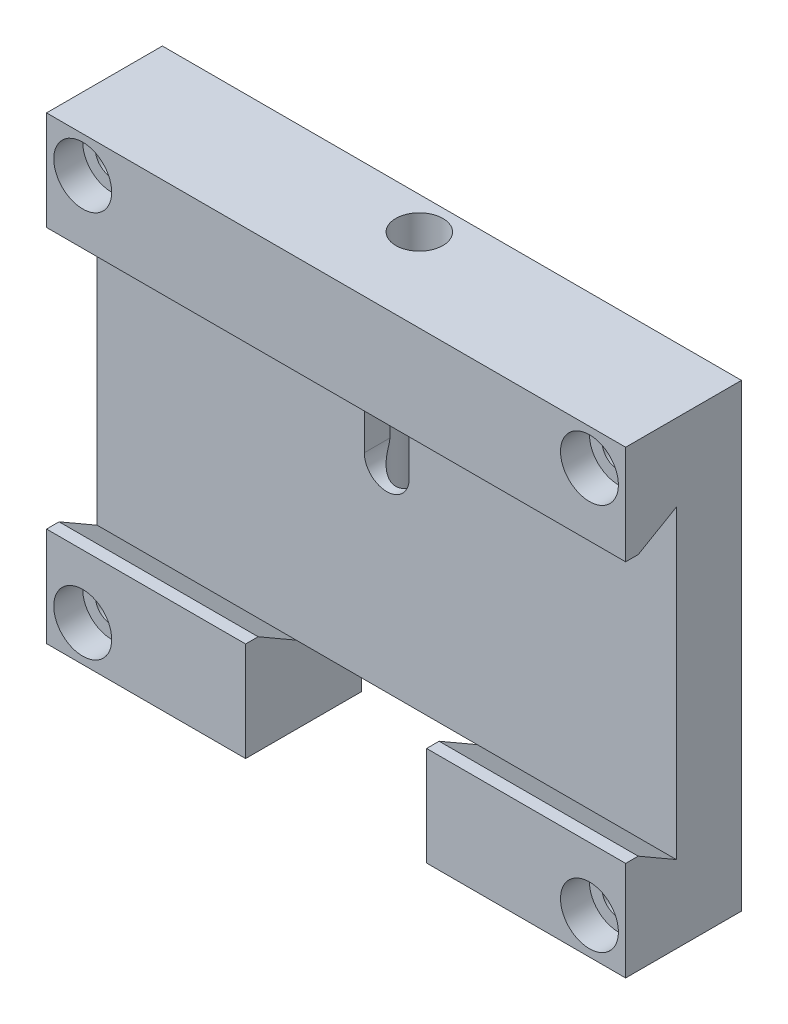
from build123d import *
from OCP.BRepFilletAPI import BRepFilletAPI_MakeChamfer

# Parameters (mm, degrees)
SKETCH_1_W                  = 80
SKETCH_1_H                  = 63.5
EXTRUDE_1_DEPTH             = 16
CUT_EXTRUDE_1_DEPTH         = 104.383992958
SKETCH_15_W                 = 25
SKETCH_15_H                 = 14.711451884
CUT_EXTRUDE_4_DEPTH         = 7
SKETCH_16_W                 = 25
SKETCH_16_H                 = 10.67
CUT_EXTRUDE_5_DEPTH         = 9
SKETCH_17_R                 = 2.5
CUT_EXTRUDE_6_DEPTH         = 4
M4X0_72_D                   = 3.3
M4X0_72_DEPTH               = 10
M4X0_72_TIP                 = 0.991420021
CUT_EXTRUDE_7_DEPTH         = 4
SKETCH_26_R                 = 3.25
CUT_EXTRUDE_8_DEPTH         = 38
HOLE_WIZARD_M41_D           = 4.5
HOLE_WIZARD_M41_CBORE_D     = 8
HOLE_WIZARD_M41_CBORE_DEPTH = 4
CHAMFER_2_SIZE              = 1
CHAMFER_2_SIZE2             = 2


with BuildPart() as part:
    # Эскиз1 → Бобышка-Вытянуть1 (new body)
    with BuildSketch(Plane.XY):
        with Locations((40, -31.75)):
            Rectangle(SKETCH_1_W, SKETCH_1_H)
    extrude(amount=EXTRUDE_1_DEPTH)

    # Эскиз2 → Вырез-Вытянуть1 (cut, through all)
    with BuildSketch(Plane.ZY):
        Polygon((9, -10.67), (16, -14.711451884), (16, -48.788548116), (9, -52.83), align=None)
    extrude(amount=-CUT_EXTRUDE_1_DEPTH, mode=Mode.SUBTRACT)

    # Эскиз15 → Вырез-Вытянуть4 (cut)
    with BuildSketch(Plane.XY.offset(16)):
        with Locations((40, -56.144274058)):
            Rectangle(SKETCH_15_W, SKETCH_15_H)
    extrude(amount=-CUT_EXTRUDE_4_DEPTH, mode=Mode.SUBTRACT)

    # Эскиз16 → Вырез-Вытянуть5 (cut)
    with BuildSketch(Plane.XY.offset(9)):
        with Locations((40, -58.165)):
            Rectangle(SKETCH_16_W, SKETCH_16_H)
    extrude(amount=-CUT_EXTRUDE_5_DEPTH, mode=Mode.SUBTRACT)

    # Эскиз17 → Вырез-Вытянуть6 (cut)
    with BuildSketch(Plane.XZ.offset(52.83)):
        with Locations(Location((32.5, 5, 0), (0, 0, 270))):
            Circle(SKETCH_17_R)
        with Locations(Location((47.5, 5, 0), (0, 0, 90))):
            Circle(SKETCH_17_R)
    extrude(amount=-CUT_EXTRUDE_6_DEPTH, mode=Mode.SUBTRACT)

    # Отверстие обработанное метчиком M4x0.72
    with Locations(Plane(origin=(0, -52.83, 0), x_dir=(-1, 0, 0), z_dir=(0, -1, 0))):
        with Locations((-40, -5)):
            Hole(M4X0_72_D / 2, depth=M4X0_72_DEPTH)
            with Locations((0, 0, -(M4X0_72_DEPTH + M4X0_72_TIP / 2))):  # 118° drill point
                Cone(0, M4X0_72_D / 2, M4X0_72_TIP, mode=Mode.SUBTRACT)

    # Эскиз25 → Вырез-Вытянуть7 (cut)
    with BuildSketch(Plane.XY.offset(9)):
        with BuildLine():
            Line((43.1, -18.711451884), (43.1, -25.711451884))
            ThreePointArc((43.1, -25.711451884), (40, -28.811451884), (36.9, -25.711451884))
            Line((36.9, -25.711451884), (36.9, -18.711451884))
            ThreePointArc((36.9, -18.711451884), (40, -15.611451884), (43.1, -18.711451884))
        make_face()
    extrude(amount=-CUT_EXTRUDE_7_DEPTH, mode=Mode.SUBTRACT)

    # Эскиз26 → Вырез-Вытянуть8 (cut)
    with BuildSketch(Plane(origin=(0, 0, 0), x_dir=(1, 0, 0), z_dir=(0, 1, 0))):
        with Locations(Location((40, -4.5, 0), (0, 0, 270))):
            Circle(SKETCH_26_R)
    extrude(amount=-CUT_EXTRUDE_8_DEPTH, mode=Mode.SUBTRACT)

    # Цековка для винта с внутренним шестигранником M41 (through all)
    with Locations(Plane(origin=(30.759227947, 26.793365177, 16), x_dir=(-1, 0, 0), z_dir=(0, 0, 1))):
        with Locations((-44.240772053, 31.793365177), (-44.240772053, 85.293365177), (25.759227947, 85.293365177), (25.759227947, 31.793365177)):
            CounterBoreHole(HOLE_WIZARD_M41_D / 2, HOLE_WIZARD_M41_CBORE_D / 2, HOLE_WIZARD_M41_CBORE_DEPTH)

    # Фаска2: one chamfer whose edges measure the first distance from different faces: ONE call of the kernel's chamfer builder (chamfer() names one face for all edges)
    chamfer_2_edges_1 = [part.edges().sort_by_distance(p)[0] for p in [
        (40, -14.711451884, 16),
    ]]
    chamfer_2_side_1 = [part.faces().sort_by_distance(p)[0] for p in [
        (40, -7.575743279, 16),
    ]]
    chamfer_2_edges_2 = [part.edges().sort_by_distance(p)[0] for p in [
        (66.25, -48.788548116, 16),
    ]]
    chamfer_2_side_2 = [part.faces().sort_by_distance(p)[0] for p in [
        (65.008612302, -55.810060435, 16),
    ]]
    chamfer_2_edges_3 = [part.edges().sort_by_distance(p)[0] for p in [
        (13.75, -48.788548116, 16),
    ]]
    chamfer_2_side_3 = [part.faces().sort_by_distance(p)[0] for p in [
        (14.991387698, -55.810060435, 16),
    ]]
    chamfer_2 = BRepFilletAPI_MakeChamfer(part.part.solid().wrapped)
    for e in chamfer_2_edges_1:
        chamfer_2.Add(CHAMFER_2_SIZE, CHAMFER_2_SIZE2, e.wrapped, chamfer_2_side_1[0].wrapped)  # the first distance lies on this face
    for e in chamfer_2_edges_2:
        chamfer_2.Add(CHAMFER_2_SIZE, CHAMFER_2_SIZE2, e.wrapped, chamfer_2_side_2[0].wrapped)  # the first distance lies on this face
    for e in chamfer_2_edges_3:
        chamfer_2.Add(CHAMFER_2_SIZE, CHAMFER_2_SIZE2, e.wrapped, chamfer_2_side_3[0].wrapped)  # the first distance lies on this face
    add(Compound.cast(chamfer_2.Shape()), mode=Mode.REPLACE)


solid = part.part
